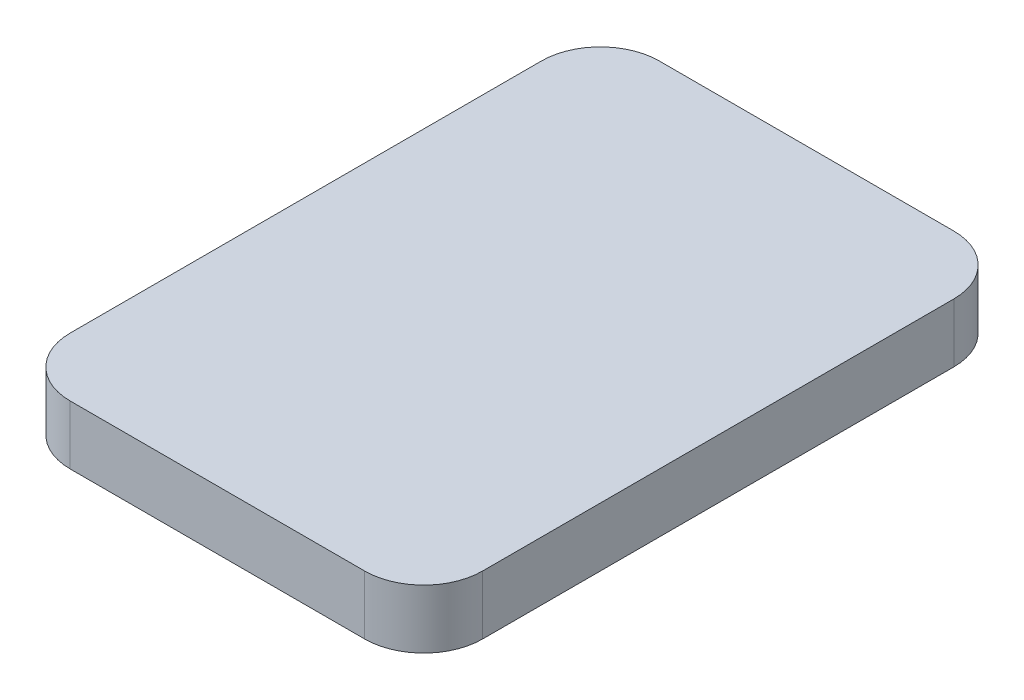
from build123d import *

# Parameters (mm, degrees)
BOSS_EXTRU_1_DEPTH = 10
CONG_2_R           = 10


with BuildPart() as part:
    # Esquisse1 → Boss.-Extru.1 (new body)
    with BuildSketch(Plane(origin=(0, 0, 0), x_dir=(1, 0, 0), z_dir=(0, 1, 0))):
        Polygon((0, 0), (70, 0), (70, -100), (40, -100), (30, -100), (0, -100), align=None)
    extrude(amount=BOSS_EXTRU_1_DEPTH)

    # Congé2
    cong_2_edges = [part.edges().sort_by_distance(p)[0] for p in [
        (0, 5, 0),
        (70, 5, 0),
        (70, 5, 100),
        (0, 5, 100),
    ]]
    fillet(cong_2_edges, radius=CONG_2_R)


solid = part.part
